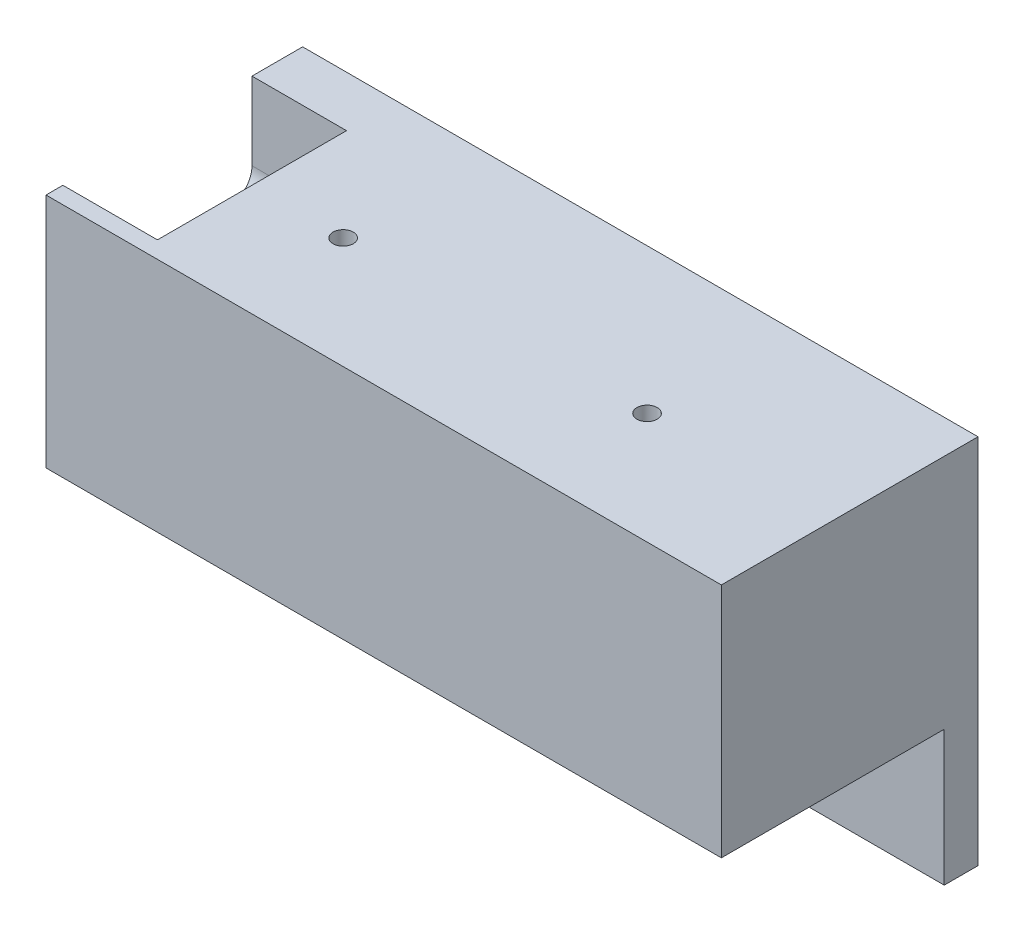
from build123d import *

# Parameters (mm, degrees)
SKIZZE1_W                       = 100
SKIZZE1_H                       = 55
AUFSATZ_LINEAR_AUSTRAGEN1_DEPTH = 38
SKIZZE2_W                       = 100
SKIZZE2_H                       = 20
SCHNITT_LINEAR_AUSTRAGEN1_DEPTH = 33
SKIZZE4_R                       = 1.5
SCHNITT_LINEAR_AUSTRAGEN2_DEPTH = 66.918510299
SKIZZE5_W                       = 92
SKIZZE5_H                       = 28
SCHNITT_LINEAR_AUSTRAGEN3_DEPTH = 30
SKIZZE6_R                       = 1.5
SCHNITT_LINEAR_AUSTRAGEN4_DEPTH = 81.274528962
VERRUNDUNG1_R                   = 3.5
SKIZZE7_W                       = 28
SKIZZE7_H                       = 15
SCHNITT_LINEAR_AUSTRAGEN5_DEPTH = 14
VERRUNDUNG5_R                   = 3.5


with BuildPart() as part:
    # Skizze1 → Aufsatz-Linear austragen1 (new body)
    with BuildSketch(Plane.XY):
        Rectangle(SKIZZE1_W, SKIZZE1_H)
    extrude(amount=AUFSATZ_LINEAR_AUSTRAGEN1_DEPTH)

    # Skizze2 → Schnitt-Linear austragen1 (cut)
    with BuildSketch(Plane.XY.offset(38)):
        with Locations((0, -17.5)):
            Rectangle(SKIZZE2_W, SKIZZE2_H)
    extrude(amount=-SCHNITT_LINEAR_AUSTRAGEN1_DEPTH, mode=Mode.SUBTRACT)

    # Skizze4 → Schnitt-Linear austragen2 (cut, through all)
    with BuildSketch(Plane.XY.offset(5)):
        with Locations((-10, -19.5)):
            Circle(SKIZZE4_R)
        with Locations((10, -19.5)):
            Circle(SKIZZE4_R)
    extrude(amount=-SCHNITT_LINEAR_AUSTRAGEN2_DEPTH, mode=Mode.SUBTRACT)

    # Skizze5 → Schnitt-Linear austragen3 (cut)
    with BuildSketch(Plane.XZ.offset(7.5)):
        with Locations((0, 21.5)):
            Rectangle(SKIZZE5_W, SKIZZE5_H)
    extrude(amount=-SCHNITT_LINEAR_AUSTRAGEN3_DEPTH, mode=Mode.SUBTRACT)

    # Skizze6 → Schnitt-Linear austragen4 (cut, through all)
    with BuildSketch(Plane.XZ.offset(-22.5)):
        with Locations(Location((-22.5, 21.5, 0), (0, 0, 270))):
            Circle(SKIZZE6_R)
        with Locations(Location((22.5, 21.5, 0), (0, 0, 270))):
            Circle(SKIZZE6_R)
    extrude(amount=-SCHNITT_LINEAR_AUSTRAGEN4_DEPTH, mode=Mode.SUBTRACT)

    # Verrundung1
    verrundung1_edges = [part.edges().sort_by_distance(p)[0] for p in [
        (-46, 7.5, 7.5),
        (-46, 7.5, 35.5),
        (46, 7.5, 35.5),
        (46, 7.5, 7.5),
    ]]
    fillet(verrundung1_edges, radius=VERRUNDUNG1_R)

    # Skizze7 → Schnitt-Linear austragen5 (cut)
    with BuildSketch(Plane.ZY.offset(50)):
        with Locations((21.5, 20)):
            Rectangle(SKIZZE7_W, SKIZZE7_H)
    extrude(amount=-SCHNITT_LINEAR_AUSTRAGEN5_DEPTH, mode=Mode.SUBTRACT)

    # Verrundung5
    verrundung5_edges = [part.edges().sort_by_distance(p)[0] for p in [
        (-46.25, 12.5, 35.5),
        (-46.25, 12.5, 7.5),
    ]]
    fillet(verrundung5_edges, radius=VERRUNDUNG5_R)


solid = part.part
